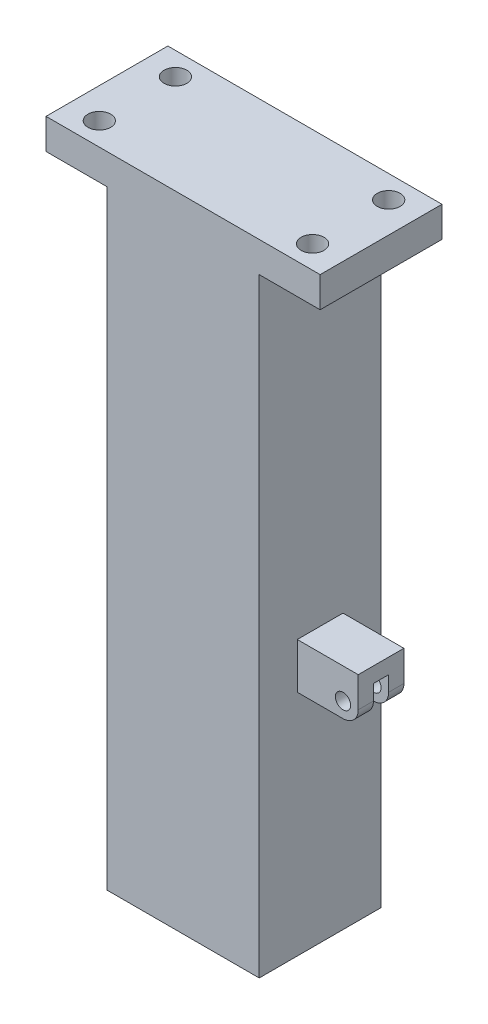
from build123d import *

# Parameters (mm, degrees)
SKETCH1_W           = 180
SKETCH1_H           = 80
BOSS_EXTRUDE1_DEPTH = 20
SKETCH2_R           = 7.5
CUT_EXTRUDE1_DEPTH  = 198.989898732
SKETCH3_W           = 100
SKETCH3_H           = 80
BOSS_EXTRUDE2_DEPTH = 400
SKETCH4_R           = 3.5
CUT_EXTRUDE2_DEPTH  = 10
SKETCH12_W          = 30
SKETCH12_H          = 30
BOSS_EXTRUDE6_DEPTH = 40
SKETCH13_R          = 5
CUT_EXTRUDE7_DEPTH  = 30
SKETCH14_W          = 10
SKETCH14_H          = 20
CUT_EXTRUDE8_DEPTH  = 20
FILLET4_R           = 10


with BuildPart() as part:
    # Sketch1 → Boss-Extrude1 (new body)
    with BuildSketch(Plane(origin=(0, 0, 0), x_dir=(1, 0, 0), z_dir=(0, 1, 0))):
        with Locations((-90, 40)):
            Rectangle(SKETCH1_W, SKETCH1_H)
    extrude(amount=BOSS_EXTRUDE1_DEPTH)

    # Sketch2 → Cut-Extrude1 (cut, through all)
    with BuildSketch(Plane(origin=(0, 20, 0), x_dir=(1, 0, 0), z_dir=(0, 1, 0))):
        with Locations(Location((-160, 65, 0), (0, 0, 270))):
            Circle(SKETCH2_R)
        with Locations(Location((-160, 15, 0), (0, 0, 270))):
            Circle(SKETCH2_R)
        with Locations(Location((-20, 65, 0), (0, 0, 270))):
            Circle(SKETCH2_R)
        with Locations(Location((-20, 15, 0), (0, 0, 270))):
            Circle(SKETCH2_R)
    extrude(amount=-CUT_EXTRUDE1_DEPTH, mode=Mode.SUBTRACT)

    # Sketch3 → Boss-Extrude2 (add)
    with BuildSketch(Plane.XZ):
        with Locations((-90, -40)):
            Rectangle(SKETCH3_W, SKETCH3_H)
    extrude(amount=BOSS_EXTRUDE2_DEPTH)

    # Sketch4 → Cut-Extrude2 (cut)
    with BuildSketch(Plane.XZ.offset(400)):
        with Locations(Location((-110, -25, 0), (0, 0, 270))):
            Circle(SKETCH4_R)
        with Locations(Location((-70, -25, 0), (0, 0, 270))):
            Circle(SKETCH4_R)
        with Locations(Location((-110, -55, 0), (0, 0, 270))):
            Circle(SKETCH4_R)
        with Locations(Location((-70, -55, 0), (0, 0, 270))):
            Circle(SKETCH4_R)
    extrude(amount=-CUT_EXTRUDE2_DEPTH, mode=Mode.SUBTRACT)

    # Sketch12 → Boss-Extrude6 (add)
    with BuildSketch(Plane(origin=(-40, 0, 0), x_dir=(0, 0, -1), z_dir=(1, 0, 0))):
        with Locations((40, -235)):
            Rectangle(SKETCH12_W, SKETCH12_H)
    extrude(amount=BOSS_EXTRUDE6_DEPTH)

    # Sketch13 → Cut-Extrude7 (cut)
    with BuildSketch(Plane.XY.offset(-25)):
        with Locations((-10, -240)):
            Circle(SKETCH13_R)
    extrude(amount=-CUT_EXTRUDE7_DEPTH, mode=Mode.SUBTRACT)

    # Sketch14 → Cut-Extrude8 (cut)
    with BuildSketch(Plane(origin=(0, 0, 0), x_dir=(0, 0, -1), z_dir=(1, 0, 0))):
        with Locations((40, -240)):
            Rectangle(SKETCH14_W, SKETCH14_H)
    extrude(amount=-CUT_EXTRUDE8_DEPTH, mode=Mode.SUBTRACT)

    # Fillet4
    fillet4_edges = [part.edges().sort_by_distance(p)[0] for p in [
        (0, -250, -30),
        (0, -250, -50),
        (-20, -230, -40),
    ]]
    fillet(fillet4_edges, radius=FILLET4_R)


solid = part.part
